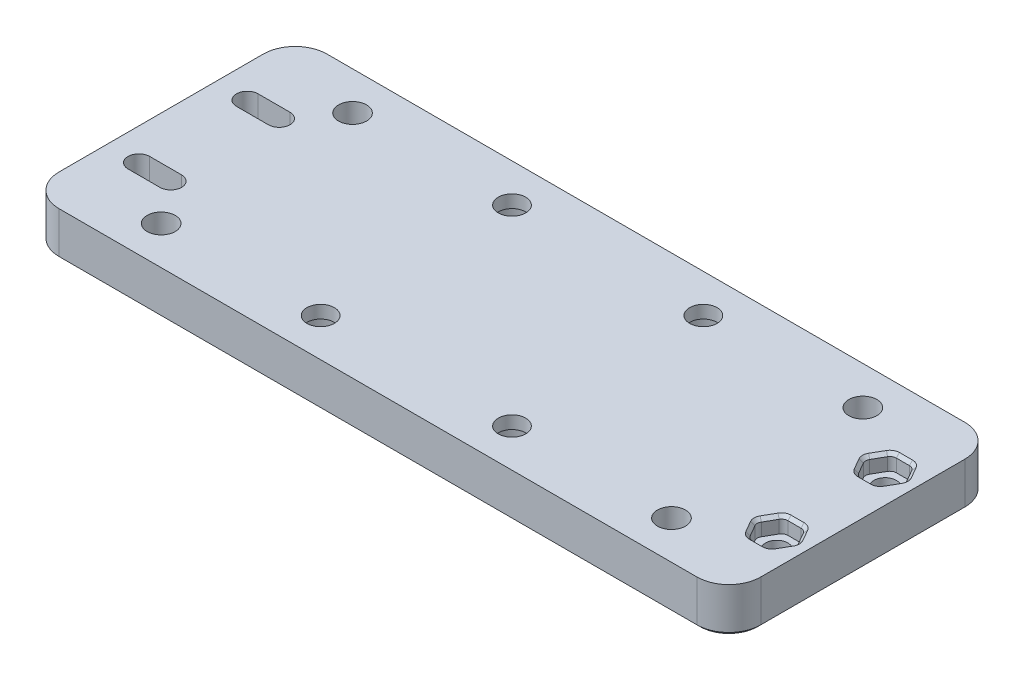
from build123d import *

# Parameters (mm, degrees)
SKETCH1_W                                           = 110
SKETCH1_H                                           = 42
BOSS_EXTRUDE1_DEPTH                                 = 7
F_4_4_4_4_DIAMETER_HOLE1_D                          = 4.4
CBORE_FOR_M4_HEX_SOCKET_HEAD_CAP_SCREW1_D           = 4.3
CBORE_FOR_M4_HEX_SOCKET_HEAD_CAP_SCREW1_CBORE_D     = 8
CBORE_FOR_M4_HEX_SOCKET_HEAD_CAP_SCREW1_CBORE_DEPTH = 5
SKETCH18_R                                          = 1.75
CUT_EXTRUDE1_DEPTH                                  = 10
FILLET1_R                                           = 5
CHAMFER1_SIZE                                       = 0.5
CUT_EXTRUDE2_DEPTH                                  = 2.5
FILLET2_R                                           = 1
CHAMFER2_SIZE                                       = 0.5


with BuildPart() as part:
    # Sketch1 → Boss-Extrude1 (new body)
    with BuildSketch(Plane(origin=(0, 0, 0), x_dir=(1, 0, 0), z_dir=(0, 1, 0))):
        Rectangle(SKETCH1_W, SKETCH1_H)
    extrude(amount=BOSS_EXTRUDE1_DEPTH)

    # Ø4.4 (4.4) Diameter Hole1 (through all)
    with Locations(Plane(origin=(0, 0, 0), x_dir=(-1, 0, 0), z_dir=(0, -1, 0))):
        with Locations((-40, 15), (-40, -15), (40, -15), (40, 15)):
            Hole(F_4_4_4_4_DIAMETER_HOLE1_D / 2)

    # CBORE for M4 Hex Socket Head Cap Screw1 (through all)
    with Locations(Plane(origin=(0, 0, 0), x_dir=(-1, 0, 0), z_dir=(0, -1, 0))):
        with Locations((-15, 15), (15, 15), (-15, -15), (15, -15)):
            CounterBoreHole(CBORE_FOR_M4_HEX_SOCKET_HEAD_CAP_SCREW1_D / 2, CBORE_FOR_M4_HEX_SOCKET_HEAD_CAP_SCREW1_CBORE_D / 2, CBORE_FOR_M4_HEX_SOCKET_HEAD_CAP_SCREW1_CBORE_DEPTH)

    # Sketch18 → Cut-Extrude1 (cut)
    with BuildSketch(Plane.XZ):
        with Locations(Location((50, 8.5, 0), (0, 0, 270))):
            Circle(SKETCH18_R)
        with Locations(Location((50, -8.5, 0), (0, 0, 270))):
            Circle(SKETCH18_R)
        with BuildLine():
            Line((-50, 10.2), (-45, 10.2))
            ThreePointArc((-45, 10.2), (-43.3, 8.5), (-45, 6.8))
            Line((-45, 6.8), (-50, 6.8))
            ThreePointArc((-50, 6.8), (-51.7, 8.5), (-50, 10.2))
        make_face()
        with BuildLine():
            Line((-50, -6.8), (-45, -6.8))
            ThreePointArc((-45, -6.8), (-43.3, -8.5), (-45, -10.2))
            Line((-45, -10.2), (-50, -10.2))
            ThreePointArc((-50, -10.2), (-51.7, -8.5), (-50, -6.8))
        make_face()
    extrude(amount=-CUT_EXTRUDE1_DEPTH, mode=Mode.SUBTRACT)

    # Fillet1
    fillet1_edges = [part.edges().sort_by_distance(p)[0] for p in [
        (55, 3.5, 21),
        (-55, 3.5, 21),
        (-55, 3.5, -21),
        (55, 3.5, -21),
    ]]
    fillet(fillet1_edges, radius=FILLET1_R)

    # Chamfer1
    chamfer1_edges = [part.edges().sort_by_distance(p)[0] for p in [
        (-55, 0, 0),
        (55, 0, 0),
        (0, 0, 21),
        (0, 0, -21),
        (-53.535533906, 0, 19.535533906),
        (53.535533906, 0, 19.535533906),
        (53.535533906, 0, -19.535533906),
        (-53.535533906, 0, -19.535533906),
        (-42.2, 0, -15),
        (-42.2, 0, 15),
        (37.8, 0, 15),
        (37.8, 0, -15),
        (-11, 0, 15),
        (19, 0, 15),
        (-11, 0, -15),
        (19, 0, -15),
        (-51.7, 0, -8.5),
        (-47.5, 0, -10.2),
        (-43.3, 0, -8.5),
        (-47.5, 0, -6.8),
        (50, 0, 10.25),
        (50, 0, -6.75),
        (-51.7, 0, 8.5),
        (-47.5, 0, 6.8),
        (-43.3, 0, 8.5),
        (-47.5, 0, 10.2),
    ]]
    chamfer(chamfer1_edges, length=CHAMFER1_SIZE)

    # Sketch22 → Cut-Extrude2 (cut)
    with BuildSketch(Plane(origin=(0, 7, 0), x_dir=(1, 0, 0), z_dir=(0, 1, 0))):
        Polygon((46.795706006, -8.5), (48.397853003, -11.275), (51.602146997, -11.275), (53.204293994, -8.5), (51.602146997, -5.725), (48.397853003, -5.725), align=None)
        Polygon((46.795706006, 8.5), (48.397853003, 5.725), (51.602146997, 5.725), (53.204293994, 8.5), (51.602146997, 11.275), (48.397853003, 11.275), align=None)
    extrude(amount=-CUT_EXTRUDE2_DEPTH, mode=Mode.SUBTRACT)

    # Fillet2
    fillet2_edges = [part.edges().sort_by_distance(p)[0] for p in [
        (46.795706006, 5.75, 8.5),
        (48.397853003, 5.75, 5.725),
        (51.602146997, 5.75, 5.725),
        (53.204293994, 5.75, 8.5),
        (51.602146997, 5.75, 11.275),
        (48.397853003, 5.75, 11.275),
        (46.795706006, 5.75, -8.5),
        (48.397853003, 5.75, -11.275),
        (51.602146997, 5.75, -11.275),
        (53.204293994, 5.75, -8.5),
        (51.602146997, 5.75, -5.725),
        (48.397853003, 5.75, -5.725),
    ]]
    fillet(fillet2_edges, radius=FILLET2_R)

    # Chamfer2
    chamfer2_edges = [part.edges().sort_by_distance(p)[0] for p in [
        (52.403220496, 7, 9.8875),
        (50, 7, 11.275),
        (52.403220496, 7, 7.1125),
        (50, 7, 5.725),
        (47.596779504, 7, 7.1125),
        (47.596779504, 7, 9.8875),
        (50, 7, -5.725),
        (47.596779504, 7, -7.1125),
        (47.596779504, 7, -9.8875),
        (50, 7, -11.275),
        (52.403220496, 7, -9.8875),
        (52.403220496, 7, -7.1125),
        (51.524796728, 7, 11.141025404),
        (53.049593456, 7, 8.5),
        (51.524796728, 7, 5.858974596),
        (48.475203272, 7, 5.858974596),
        (46.950406544, 7, 8.5),
        (48.475203272, 7, 11.141025404),
        (48.475203272, 7, -5.858974596),
        (46.950406544, 7, -8.5),
        (48.475203272, 7, -11.141025404),
        (51.524796728, 7, -11.141025404),
        (53.049593456, 7, -8.5),
        (51.524796728, 7, -5.858974596),
    ]]
    chamfer(chamfer2_edges, length=CHAMFER2_SIZE)


solid = part.part
